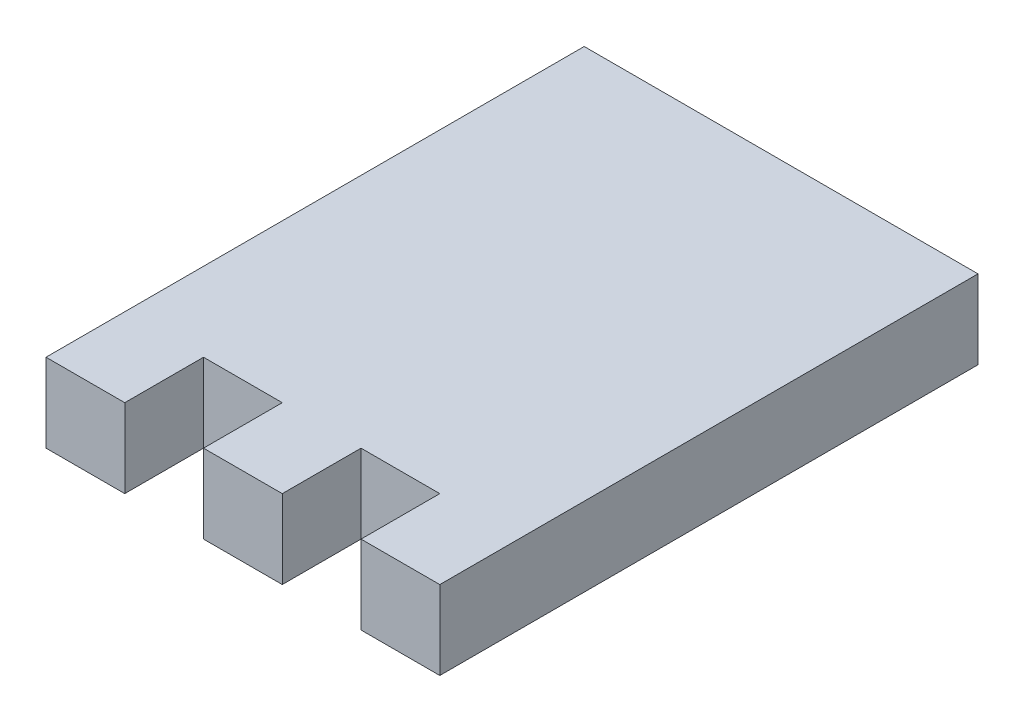
from build123d import *

# Parameters (mm, degrees)
BOSS_EXTRUDE1_DEPTH = 3


with BuildPart() as part:
    # Sketch1 → Boss-Extrude1 (new body)
    with BuildSketch(Plane(origin=(0, 0, 0), x_dir=(1, 0, 0), z_dir=(0, 1, 0))):
        Polygon((-7.480982321, -7.627510626), (-4.480982321, -7.627510626), (-4.480982321, -4.627510626), (-1.480982321, -4.627510626), (-1.480982321, -7.627510626), (1.519017679, -7.627510626), (1.519017679, -4.627510626), (4.519017679, -4.627510626), (4.519017679, -7.627510626), (7.519017679, -7.627510626), (7.519017679, 12.872489374), (-7.480982321, 12.872489374), align=None)
    extrude(amount=BOSS_EXTRUDE1_DEPTH)


solid = part.part
